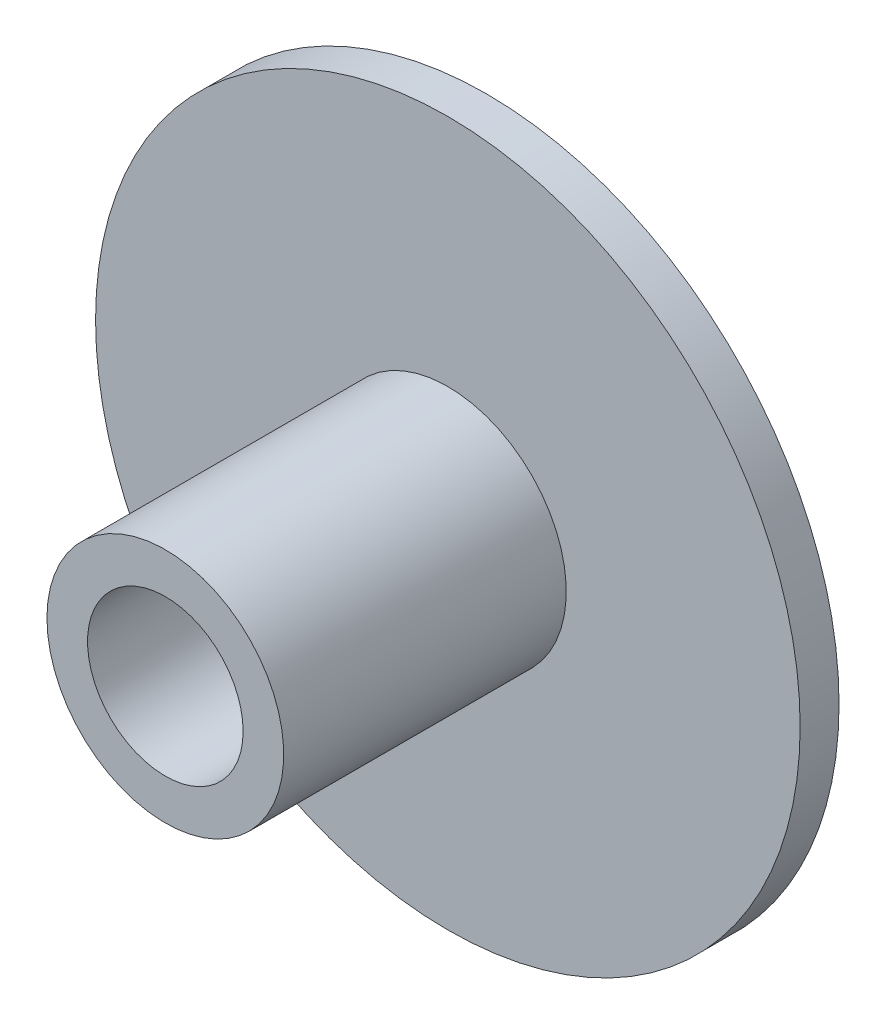
from build123d import *

# Parameters (mm, degrees)
SKETCH1_R                 = 7.8232
BOSS_EXTRUDE1_DEPTH       = 0.8636
SKETCH2_R                 = 2.6289
BOSS_EXTRUDE2_DEPTH       = 6.2738
TAP_DRILL_FOR_8_32_TAP1_D = 3.4544


with BuildPart() as part:
    # Sketch1 → Boss-Extrude1 (new body)
    with BuildSketch(Plane.XY):
        Circle(SKETCH1_R)
    extrude(amount=BOSS_EXTRUDE1_DEPTH)

    # Sketch2 → Boss-Extrude2 (add)
    with BuildSketch(Plane.XY.offset(0.8636)):
        with Locations(Location((0, 0, 0), (0, 0, 180))):
            Circle(SKETCH2_R)
    extrude(amount=BOSS_EXTRUDE2_DEPTH)

    # Tap Drill for #8-32 Tap1 (through all)
    with Locations(Plane.XY.offset(7.1374)):
        with Locations((0, 0)):
            Hole(TAP_DRILL_FOR_8_32_TAP1_D / 2)


solid = part.part
